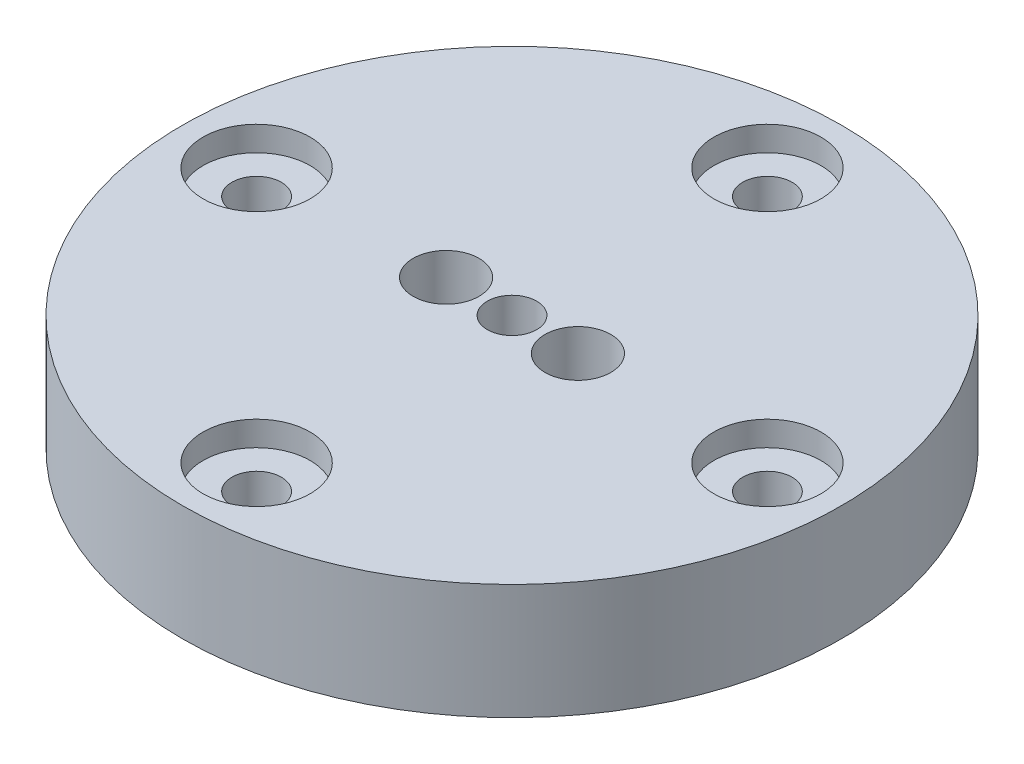
from build123d import *

# Parameters (mm, degrees)
SKETCH1_R           = 20
SKETCH1_R_2         = 1.5
SKETCH1_R_3         = 2
BOSS_EXTRUDE1_DEPTH = 7
SKETCH2_R           = 3.25
CUT_EXTRUDE1_DEPTH  = 1.5


with BuildPart() as part:
    # Sketch1 → Boss-Extrude1 (new body)
    with BuildSketch(Plane(origin=(0, 0, 0), x_dir=(1, 0, 0), z_dir=(0, 1, 0))):
        with Locations(Location((0, 0, 0), (0, 0, 270))):
            Circle(SKETCH1_R)
        with Locations(Location((0, 15.5, 0), (0, 0, 270))):
            Circle(SKETCH1_R_2, mode=Mode.SUBTRACT)
        with Locations(Location((15.5, 0, 0), (0, 0, 270))):
            Circle(SKETCH1_R_2, mode=Mode.SUBTRACT)
        with Locations(Location((0, -15.5, 0), (0, 0, 270))):
            Circle(SKETCH1_R_2, mode=Mode.SUBTRACT)
        with Locations(Location((-15.5, 0, 0), (0, 0, 270))):
            Circle(SKETCH1_R_2, mode=Mode.SUBTRACT)
        with Locations(Location((-4, 0, 0), (0, 0, 270))):
            Circle(SKETCH1_R_3, mode=Mode.SUBTRACT)
        with Locations(Location((4, 0, 0), (0, 0, 270))):
            Circle(SKETCH1_R_3, mode=Mode.SUBTRACT)
        with Locations(Location((0, 0, 0), (0, 0, 270))):
            Circle(SKETCH1_R_2, mode=Mode.SUBTRACT)
    extrude(amount=BOSS_EXTRUDE1_DEPTH)

    # Sketch2 → Cut-Extrude1 (cut)
    with BuildSketch(Plane(origin=(0, 7, 0), x_dir=(1, 0, 0), z_dir=(0, 1, 0))):
        with Locations(Location((0, 15.5, 0), (0, 0, 270))):
            Circle(SKETCH2_R)
        with Locations(Location((15.5, 0, 0), (0, 0, 270))):
            Circle(SKETCH2_R)
        with Locations(Location((0, -15.5, 0), (0, 0, 270))):
            Circle(SKETCH2_R)
        with Locations(Location((-15.5, 0, 0), (0, 0, 270))):
            Circle(SKETCH2_R)
    extrude(amount=-CUT_EXTRUDE1_DEPTH, mode=Mode.SUBTRACT)


solid = part.part
